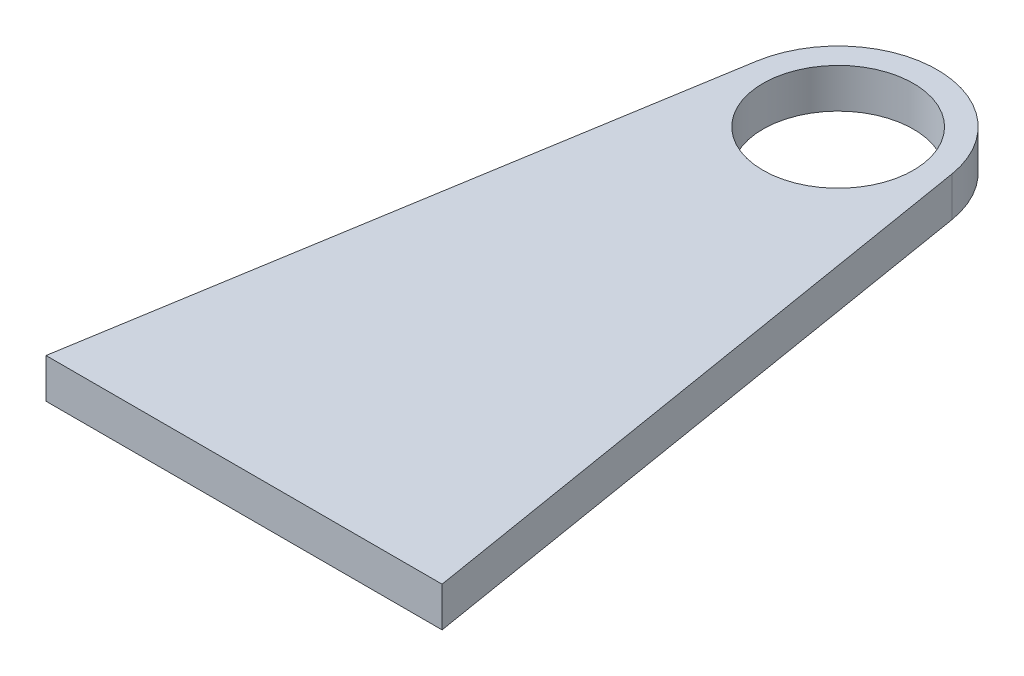
from build123d import *

# Parameters (mm, degrees)
SKETCH1_R           = 9.5
BOSS_EXTRUDE1_DEPTH = 5


with BuildPart() as part:
    # Sketch1 → Boss-Extrude1 (new body)
    with BuildSketch(Plane(origin=(0, 0, 0), x_dir=(1, 0, 0), z_dir=(0, 1, 0))):
        with BuildLine():
            Line((-25, -75), (25, -75))
            Line((25, -75), (12.334371247, 2.028123749))
            ThreePointArc((12.334371247, 2.028123749), (0, 12.5), (-12.334371247, 2.028123749))
            Line((-12.334371247, 2.028123749), (-25, -75))
        make_face()
        with Locations(Location((0, 0, 0), (0, 0, 270))):
            Circle(SKETCH1_R, mode=Mode.SUBTRACT)
    extrude(amount=BOSS_EXTRUDE1_DEPTH)


solid = part.part
